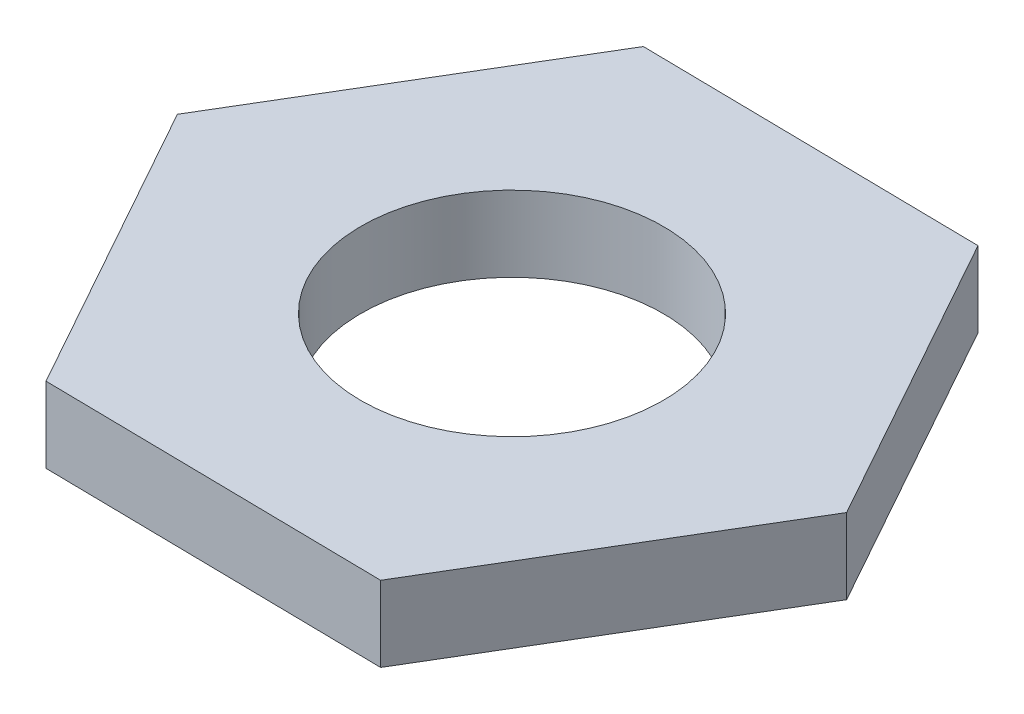
from build123d import *

# Parameters (mm, degrees)
CROQUIS1_R              = 2
SALIENTE_EXTRUIR1_DEPTH = 1


with BuildPart() as part:
    # Croquis1 → Saliente-Extruir1 (new body)
    with BuildSketch(Plane(origin=(0, 0, 0), x_dir=(1, 0, 0), z_dir=(0, 1, 0))):
        Polygon((4.499486345, -0.067989954), (2.3086242, 3.862674501), (-2.190862145, 3.930664455), (-4.499486345, 0.067989954), (-2.3086242, -3.862674501), (2.190862145, -3.930664455), align=None)
        with Locations(Location((0, 0, 0), (0, 0, 270))):
            Circle(CROQUIS1_R, mode=Mode.SUBTRACT)
    extrude(amount=SALIENTE_EXTRUIR1_DEPTH)


solid = part.part
